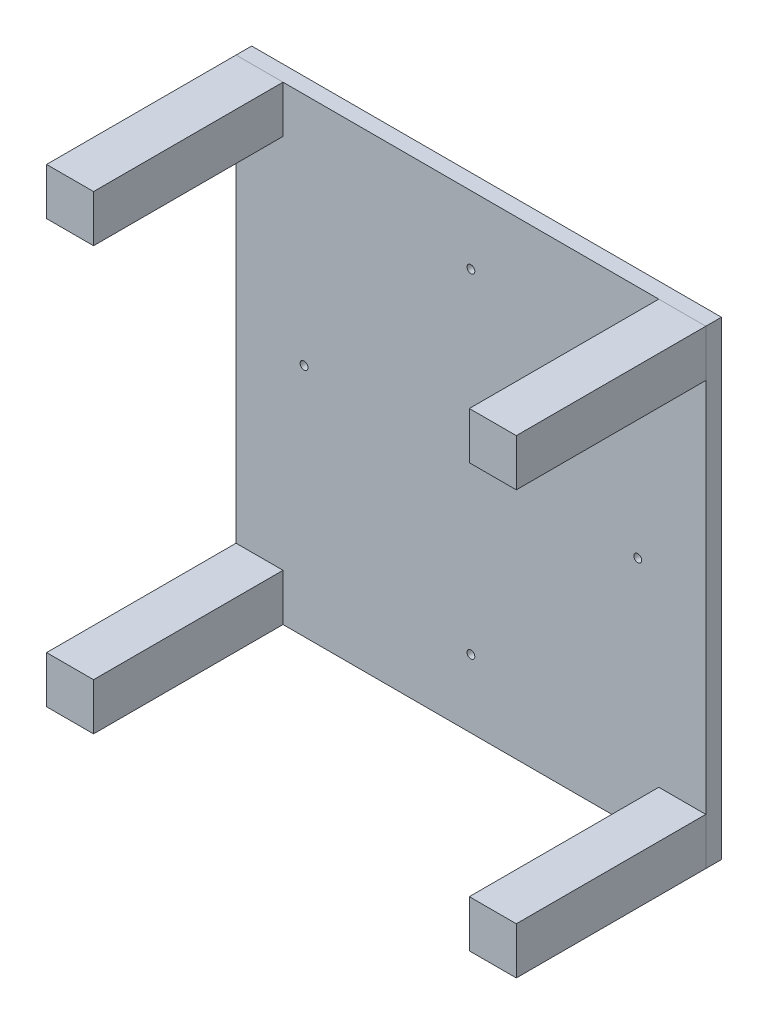
from build123d import *

# Parameters (mm, degrees)
SKETCH1_W             = 300
SKETCH1_H             = 300
SKETCH1_R             = 2.5
BOSS_EXTRUDE1_DEPTH   = 10
SKETCH2_W             = 30
SKETCH2_H             = 30
BOSS_EXTRUDE2_DEPTH   = 121
BOSS_EXTRUDE2_2_DEPTH = 121
BOSS_EXTRUDE2_3_DEPTH = 121
BOSS_EXTRUDE2_4_DEPTH = 121


with BuildPart() as part:
    # Sketch1 → Boss-Extrude1 (new body)
    with BuildSketch(Plane.XY):
        Rectangle(SKETCH1_W, SKETCH1_H)
        with Locations((0, -106.562672681)):
            Circle(SKETCH1_R, mode=Mode.SUBTRACT)
        with Locations((-106.562672681, 0)):
            Circle(SKETCH1_R, mode=Mode.SUBTRACT)
        with Locations((106.562672681, 0)):
            Circle(SKETCH1_R, mode=Mode.SUBTRACT)
        with Locations((0, 106.562672681)):
            Circle(SKETCH1_R, mode=Mode.SUBTRACT)
    extrude(amount=BOSS_EXTRUDE1_DEPTH)


with BuildPart() as body_2:
    # Sketch2 → Boss-Extrude2 (new body)
    with BuildSketch(Plane.XY.offset(10)):
        with Locations((-135, 135)):
            Rectangle(SKETCH2_W, SKETCH2_H)
    extrude(amount=BOSS_EXTRUDE2_DEPTH)


with BuildPart() as body_3:
    # Sketch2 → Boss-Extrude2 2 (new body)
    with BuildSketch(Plane.XY.offset(10)):
        with Locations((135, 135)):
            Rectangle(SKETCH2_W, SKETCH2_H)
    extrude(amount=BOSS_EXTRUDE2_2_DEPTH)


with BuildPart() as body_4:
    # Sketch2 → Boss-Extrude2 3 (new body)
    with BuildSketch(Plane.XY.offset(10)):
        with Locations((-135, -135)):
            Rectangle(SKETCH2_W, SKETCH2_H)
    extrude(amount=BOSS_EXTRUDE2_3_DEPTH)


with BuildPart() as body_5:
    # Sketch2 → Boss-Extrude2 4 (new body)
    with BuildSketch(Plane.XY.offset(10)):
        with Locations((135, -135)):
            Rectangle(SKETCH2_W, SKETCH2_H)
    extrude(amount=BOSS_EXTRUDE2_4_DEPTH)


solid = Compound([part.part, body_2.part, body_3.part, body_4.part, body_5.part])
